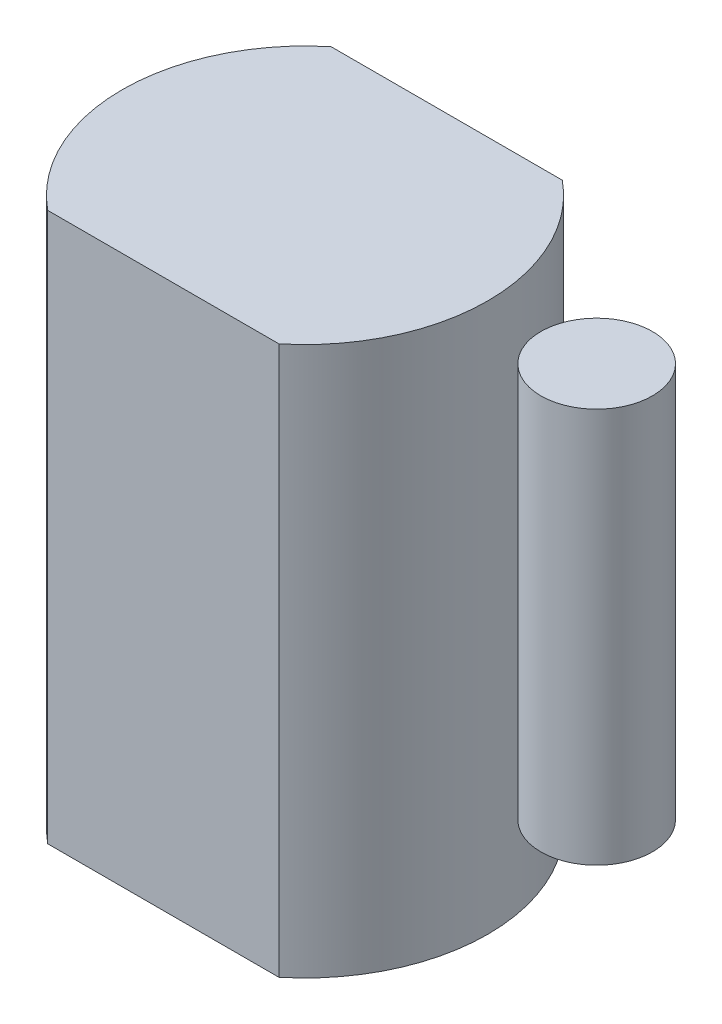
from build123d import *

# Parameters (mm, degrees)
RESSALTO_EXTRUS_O1_DEPTH = 30
ESBO_O3_R                = 3.05
RESSALTO_EXTRUS_O2_DEPTH = 21.6


with BuildPart() as part:
    # Esboço2 → Ressalto-extrusão1 (new body)
    with BuildSketch(Plane(origin=(0, 0, 0), x_dir=(1, 0, 0), z_dir=(0, 1, 0))):
        with BuildLine():
            Line((-6.31961233, -7.75), (6.31961233, -7.75))
            ThreePointArc((6.31961233, -7.75), (10, 0), (6.31961233, 7.75))
            Line((6.31961233, 7.75), (-6.31961233, 7.75))
            ThreePointArc((-6.31961233, 7.75), (-10, 0), (-6.31961233, -7.75))
        make_face()
    extrude(amount=RESSALTO_EXTRUS_O1_DEPTH)


with BuildPart() as body_2:
    # Esboço3 → Ressalto-extrusão2 (new body)
    with BuildSketch(Plane(origin=(0, 30, 0), x_dir=(1, 0, 0), z_dir=(0, 1, 0))):
        with Locations(Location((15.95, 0, 0), (0, 0, 270))):
            Circle(ESBO_O3_R)
    extrude(amount=-RESSALTO_EXTRUS_O2_DEPTH)


solid = Compound([part.part, body_2.part])
